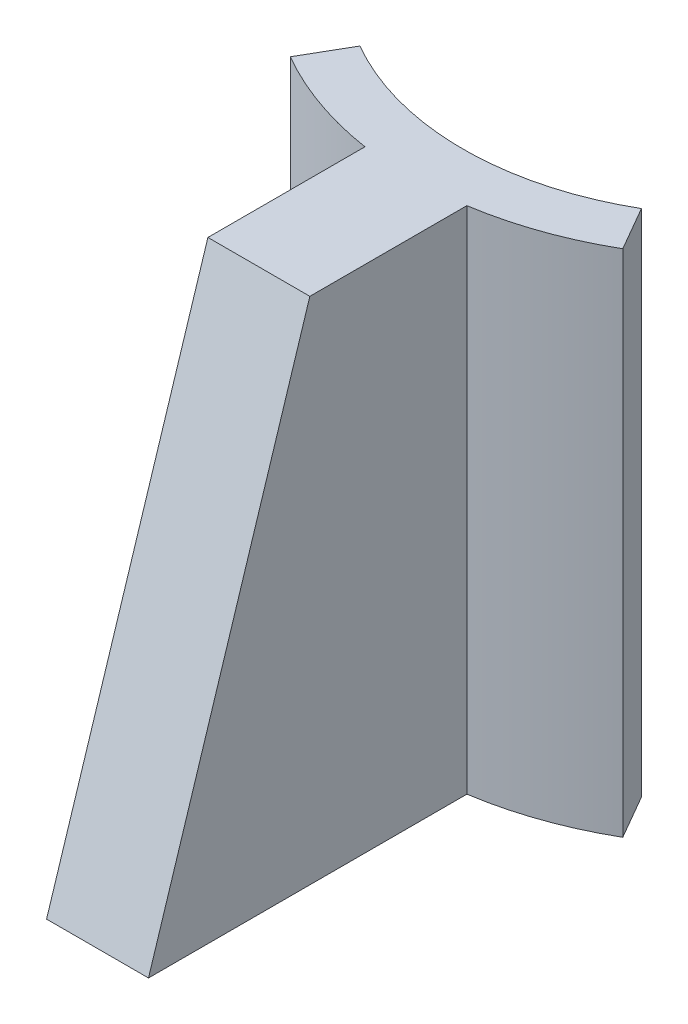
from build123d import *

# Parameters (mm, degrees)
BOSS_EXTRUDE1_DEPTH      = 0.5
BOSS_EXTRUDE1_DEPTH_BACK = 0.5
BOSS_EXTRUDE2_DEPTH      = 2.5
BOSS_EXTRUDE2_DEPTH_BACK = 2.5


with BuildPart() as part:
    # Sketch1 → Boss-Extrude1 (new, two sides: drawn at the far end of the back side and taken through both)
    with BuildSketch(Plane(origin=(0, 0, 0), x_dir=(0, 0, -1), z_dir=(1, 0, 0)).offset(-BOSS_EXTRUDE1_DEPTH_BACK)):
        Polygon((-2.836617921, 9), (-3.261901286, 9), (-4.763807052, 9), (-6.346474592, 4), (-3.261901286, 4), (-2.836617921, 4), align=None)
    extrude(amount=BOSS_EXTRUDE1_DEPTH + BOSS_EXTRUDE1_DEPTH_BACK)

    # Sketch2 → Boss-Extrude2 (add, two sides: drawn at the far end of the back side and taken through both)
    with BuildSketch(Plane(origin=(0, 6.5, 0), x_dir=(1, 0, 0), z_dir=(0, 1, 0)).offset(-BOSS_EXTRUDE2_DEPTH_BACK)):
        with BuildLine():
            Line((-1.380950907, -2.391876524), (-1.630950928, -2.824889214))
            ThreePointArc((-1.630950928, -2.824889214), (-0.844242346, -3.150754649), (-2.4e-08, -3.261901286))
            ThreePointArc((-2.4e-08, -3.261901286), (0.8442423, -3.150754662), (1.630950886, -2.824889238))
            Line((1.630950886, -2.824889238), (1.380950907, -2.391876524))
            ThreePointArc((1.380950907, -2.391876524), (0.714832801, -2.667791742), (0, -2.761901286))
            ThreePointArc((0, -2.761901286), (-0.714832801, -2.667791742), (-1.380950907, -2.391876524))
        make_face()
    extrude(amount=BOSS_EXTRUDE2_DEPTH + BOSS_EXTRUDE2_DEPTH_BACK)


solid = part.part
